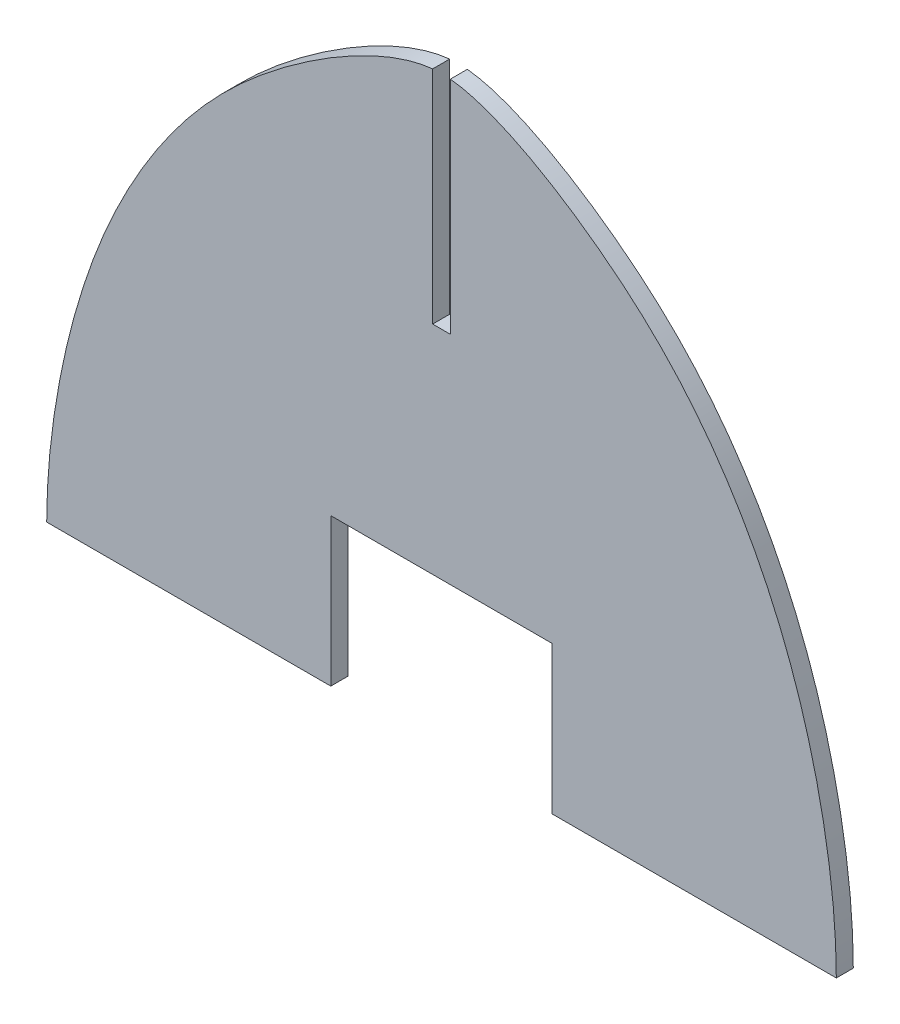
from build123d import *

# Parameters (mm, degrees)
BOSS_EXTRUDE1_DEPTH = 5.842
SKETCH4_W           = 38.1
SKETCH4_H           = 50.8
SKETCH4_W_2         = 3.048
SKETCH4_H_2         = 76.2
CUT_EXTRUDE2_DEPTH  = 277.973416612


with BuildPart() as part:
    # Sketch3 → Boss-Extrude1 (new body)
    with BuildSketch(Plane.XY):
        with BuildLine():
            Line((0, 241.3), (0, 39.6875))
            Line((0, 39.6875), (135.847173209, 39.6875))
            add(Edge.make_bspline(
                [(0, 241.3), (14.73835438, 241.3), (59.624010151, 216.373546587), (96.769766419, 175.903175742), (127.183964056, 115.738105555), (135.847173209, 66.091328973), (135.847173209, 39.6875)],
                knots=[0, 0, 0, 0, 0.227729534, 0.472592903, 0.661218042, 1, 1, 1, 1], degree=3))
        make_face()
    extrude(amount=BOSS_EXTRUDE1_DEPTH)

    # Sketch4 → Cut-Extrude2 (cut, through all)
    with BuildSketch(Plane.XY):
        with Locations((19.05, 65.0875)):
            Rectangle(SKETCH4_W, SKETCH4_H)
        with Locations((1.524, 203.2)):
            Rectangle(SKETCH4_W_2, SKETCH4_H_2)
    extrude(amount=CUT_EXTRUDE2_DEPTH, mode=Mode.SUBTRACT)

    # Mirror2: part across plane


with BuildPart() as part_1:
    add(part.part)
    add(part.part.mirror(Plane(origin=(0, 0, 0), x_dir=(0, 0, 1), z_dir=(1, 0, 0))))


solid = part_1.part
